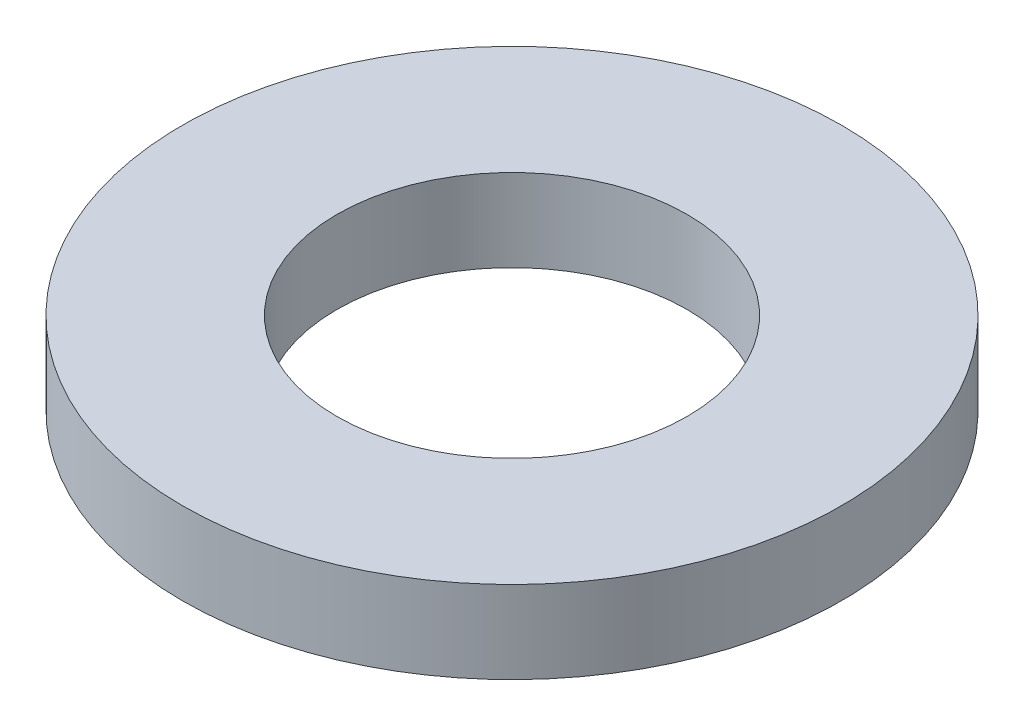
from build123d import *

# Parameters (mm, degrees)
SKETCH1_R           = 8
SKETCH1_R_2         = 4.25
BOSS_EXTRUDE1_DEPTH = 2


with BuildPart() as part:
    # Sketch1 → Boss-Extrude1 (new body)
    with BuildSketch(Plane(origin=(0, 0, 0), x_dir=(1, 0, 0), z_dir=(0, 1, 0))):
        with Locations(Location((0, 0, 0), (0, 0, 270))):
            Circle(SKETCH1_R)
        with Locations(Location((0, 0, 0), (0, 0, 270))):
            Circle(SKETCH1_R_2, mode=Mode.SUBTRACT)
    extrude(amount=BOSS_EXTRUDE1_DEPTH)


solid = part.part
